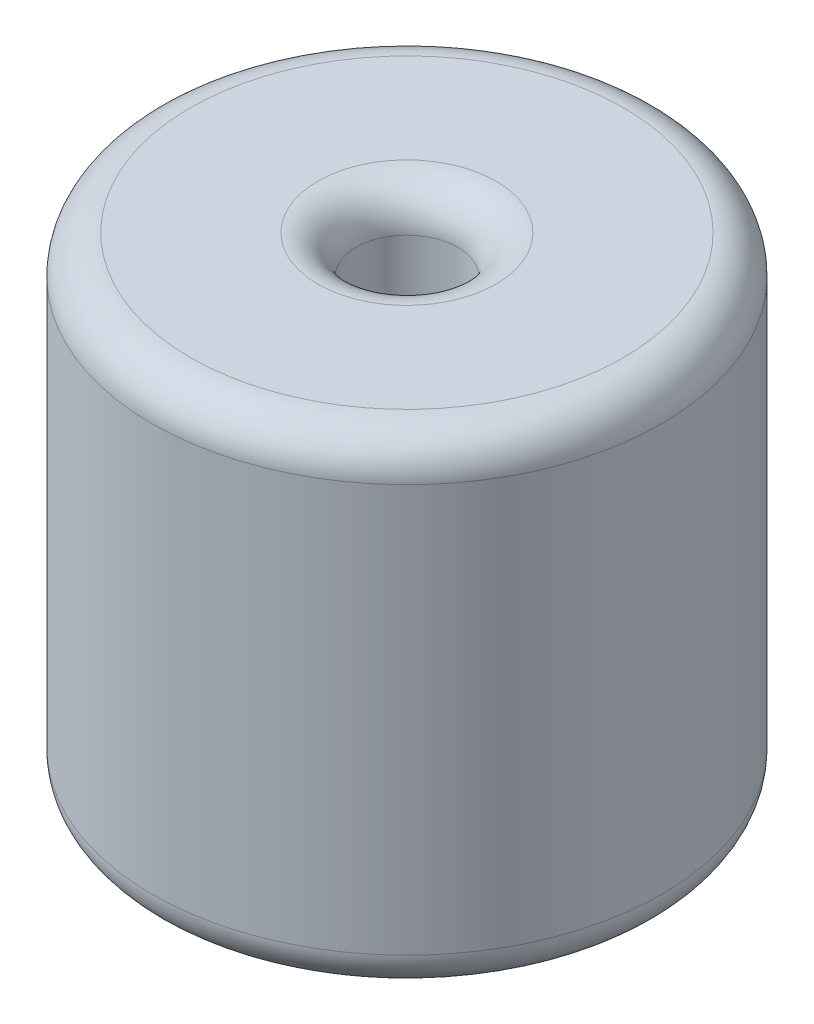
from build123d import *

# Parameters (mm, degrees)
SKETCH1_R           = 20
BOSS_EXTRUDE1_DEPTH = 38
SKETCH4_R           = 4
CUT_EXTRUDE1_DEPTH  = 48.370877129
FILLET1_R           = 3


with BuildPart() as part:
    # Sketch1 → Boss-Extrude1 (new body)
    with BuildSketch(Plane(origin=(0, 0, 0), x_dir=(1, 0, 0), z_dir=(0, 1, 0))):
        with Locations(Location((0, 0, 0), (0, 0, 270))):
            Circle(SKETCH1_R)
    extrude(amount=BOSS_EXTRUDE1_DEPTH)

    # Sketch4 → Cut-Extrude1 (cut, through all)
    with BuildSketch(Plane(origin=(0, 38, 0), x_dir=(1, 0, 0), z_dir=(0, 1, 0))):
        with Locations(Location((0, 0, 0), (0, 0, 270))):
            Circle(SKETCH4_R)
    extrude(amount=-CUT_EXTRUDE1_DEPTH, mode=Mode.SUBTRACT)

    # Fillet1
    fillet1_edges = [part.edges().sort_by_distance(p)[0] for p in [
        (0, 0, -20),
        (0, 38, -20),
        (0, 0, -4),
        (0, 38, -4),
    ]]
    fillet(fillet1_edges, radius=FILLET1_R)


solid = part.part
